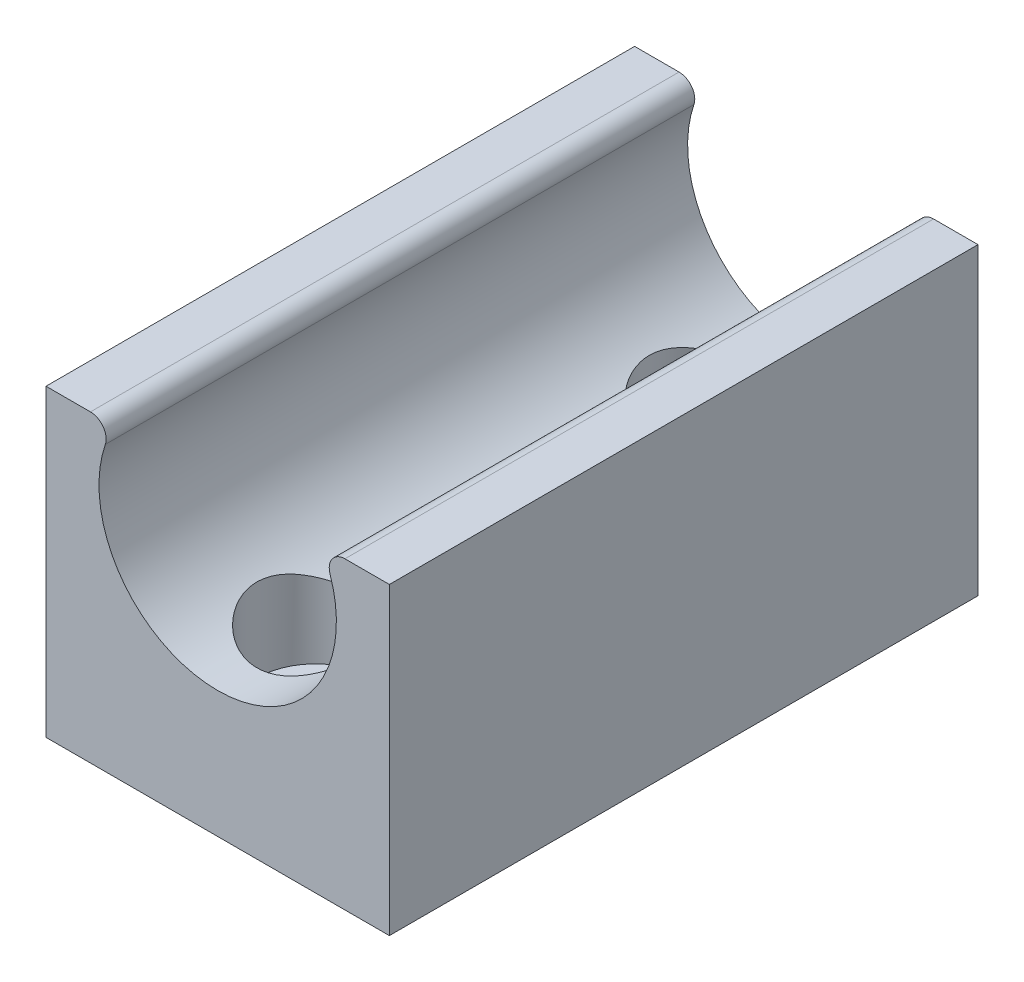
from build123d import *

# Parameters (mm, degrees)
BOSS_EXTRUDE1_DEPTH = 30
FILLET1_R           = 0.8
SKETCH3_R           = 3
CUT_EXTRUDE1_DEPTH  = 12.5
SKETCH4_R           = 1.55
CUT_EXTRUDE2_DEPTH  = 35.882839707


with BuildPart() as part:
    # Sketch1 → Boss-Extrude1 (new body)
    with BuildSketch(Plane.XY):
        with BuildLine():
            Line((-5.25, 7.75), (-8.75, 7.75))
            Line((-8.75, 7.75), (-8.75, -7.75))
            Line((-8.75, -7.75), (8.75, -7.75))
            Line((8.75, -7.75), (8.75, 7.75))
            Line((8.75, 7.75), (5.25, 7.75))
            ThreePointArc((5.25, 7.75), (0, -1.306659276), (-5.25, 7.75))
        make_face()
    extrude(amount=BOSS_EXTRUDE1_DEPTH)

    # Fillet1
    fillet1_edges = [part.edges().sort_by_distance(p)[0] for p in [
        (-5.25, 7.75, 15),
        (5.25, 7.75, 15),
    ]]
    fillet(fillet1_edges, radius=FILLET1_R)

    # Sketch3 → Cut-Extrude1 (cut)
    with BuildSketch(Plane(origin=(0, 7.75, 0), x_dir=(1, 0, 0), z_dir=(0, 1, 0))):
        with Locations(Location((0, -5, 0), (0, 0, 180))):
            Circle(SKETCH3_R)
        with Locations(Location((0, -25, 0), (0, 0, 180))):
            Circle(SKETCH3_R)
    extrude(amount=-CUT_EXTRUDE1_DEPTH, mode=Mode.SUBTRACT)

    # Sketch4 → Cut-Extrude2 (cut, through all)
    with BuildSketch(Plane(origin=(0, 7.75, 0), x_dir=(1, 0, 0), z_dir=(0, 1, 0))):
        with Locations(Location((0, -5, 0), (0, 0, 180))):
            Circle(SKETCH4_R)
        with Locations(Location((0, -25, 0), (0, 0, 180))):
            Circle(SKETCH4_R)
    extrude(amount=-CUT_EXTRUDE2_DEPTH, mode=Mode.SUBTRACT)


solid = part.part
